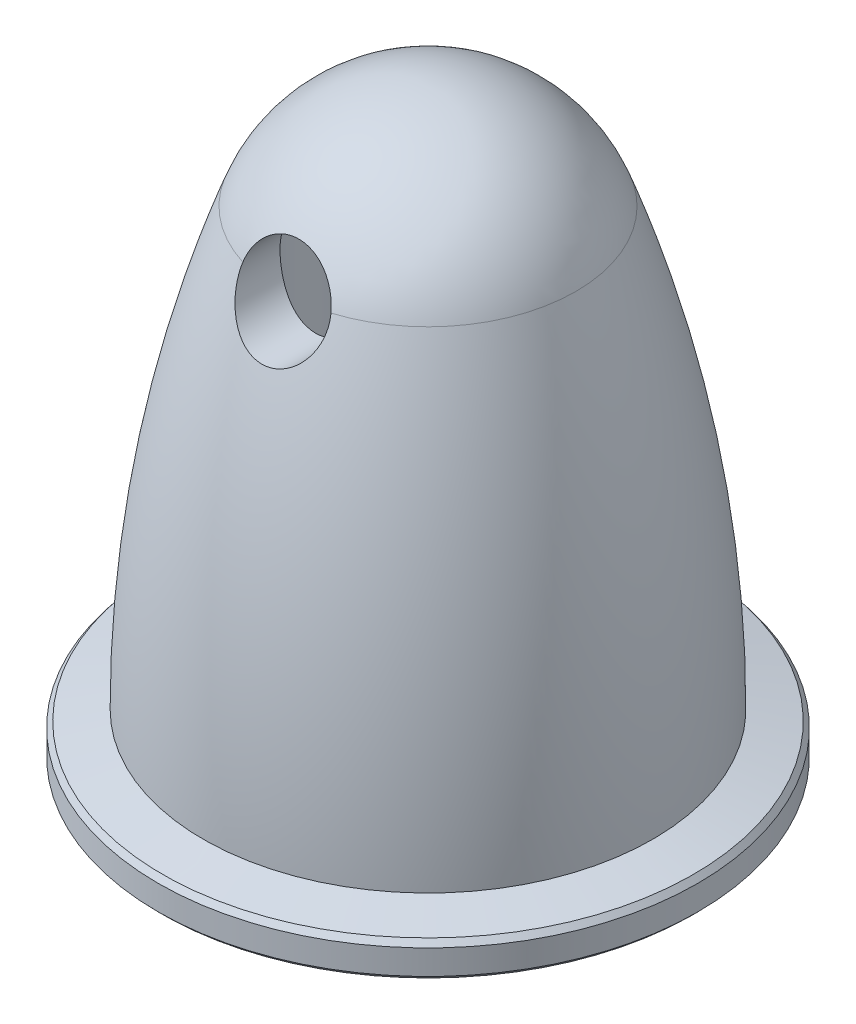
from build123d import *

# Parameters (mm, degrees)
CUT_EXTRUDE1_REACH             = 17.524
SKETCH2_R                      = 1
CUT_EXTRUDE1_DIRECTION_2_REACH = 17.524


with BuildPart() as part:
    # Sketch1 → Revolve1 (revolve)
    with BuildSketch(Plane.XY, mode=Mode.PRIVATE) as revolve1_sk:
        with BuildLine():
            Line((2.75, 0), (5.9, 0))
            Line((5.9, 0), (6, 0.1))
            Line((6, 0.1), (6, 0.65))
            Line((6, 0.65), (5.90298575, 0.774253563))
            Line((5.90298575, 0.774253563), (5, 1))
            ThreePointArc((5, 1), (4.5688675, 5.923917794), (3.288590604, 10.697986577))
            ThreePointArc((3.288590604, 10.697986577), (2.007118205, 12.367311722), (0, 13))
            Line((0, 13), (0, 11.75))
            Line((0, 11.75), (2.5, 11))
            Line((2.5, 11), (2.5, 0.25))
            Line((2.5, 0.25), (2.75, 0))
        make_face()
    revolve(revolve1_sk.sketch.rotate(Axis((0, 11.75, 0), (0, 1, 0)), 90), axis=Axis((0, 11.75, 0), (0, 1, 0)))

    # Sketch2 → Cut-Extrude1 (cut, up to next)
    with BuildSketch(Plane.XY, mode=Mode.PRIVATE) as cut_extrude1_sk1:
        with Locations(Location((0, 10.5, 0), (0, 0, 179.156103364))):
            Circle(SKETCH2_R)
    cut_extrude1_tool1 = extrude(cut_extrude1_sk1.sketch, amount=-CUT_EXTRUDE1_REACH, mode=Mode.PRIVATE) & part.part
    add(cut_extrude1_tool1.solids().sort_by_distance((0, 10.5, 0))[0], mode=Mode.SUBTRACT)

    # Sketch2 → Cut-Extrude1 direction 2 (cut, up to next)
    with BuildSketch(Plane.XY, mode=Mode.PRIVATE) as cut_extrude1_direction_2_sk1:
        with Locations(Location((0, 10.5, 0), (0, 0, 179.156103364))):
            Circle(SKETCH2_R)
    cut_extrude1_direction_2_tool1 = extrude(cut_extrude1_direction_2_sk1.sketch, amount=CUT_EXTRUDE1_DIRECTION_2_REACH, mode=Mode.PRIVATE) & part.part
    add(cut_extrude1_direction_2_tool1.solids().sort_by_distance((0, 10.5, 0))[0], mode=Mode.SUBTRACT)


solid = part.part
